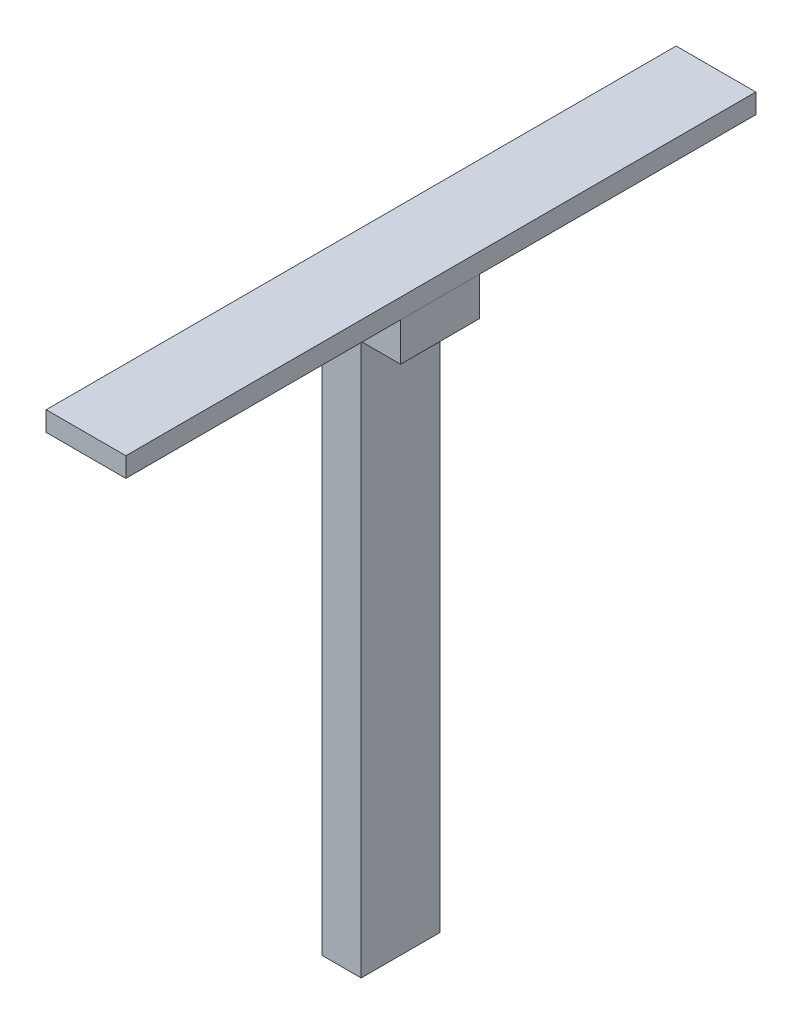
from build123d import *

# Parameters (mm, degrees)
EXTRUDE_1_DEPTH      = 150
EXTRUDE_2_DEPTH      = 70
EXTRUDE_2_DEPTH_BACK = 90
SKETCH_7_W           = 20.232494165
SKETCH_7_H           = 5
SKETCH_8_W           = 10
SKETCH_8_H           = 20
CUT_EXTRUDE_1_DEPTH  = 140


with BuildPart() as part:
    # Sketch 3D_1 → 凸台-拉伸1 (new body)
    with BuildSketch(Plane(origin=(0, 0, 0), x_dir=(0.7071067811865476, 0, 0.7071067811865476), z_dir=(0, 1, 0))):
        Polygon((0, 0), (14.142135624, 14.142135624), (28.284271247, 0), (14.142135624, -14.142135624), align=None)
    extrude(amount=EXTRUDE_1_DEPTH)

    # 草图8 → 切除-拉伸1 (cut)
    with BuildSketch(Plane(origin=(0, 0, 0), x_dir=(-1, 0, 0), z_dir=(0, -1, 0))):
        with Locations((-15, -10)):
            Rectangle(SKETCH_8_W, SKETCH_8_H)
    extrude(amount=-CUT_EXTRUDE_1_DEPTH, mode=Mode.SUBTRACT)


with BuildPart() as body_2:
    # 草图7 → 凸台-拉伸2 (new, two sides: drawn at the far end of the back side and taken through both)
    with BuildSketch(Plane.XY.offset(20).offset(-EXTRUDE_2_DEPTH_BACK)):
        with Locations((10.116247083, 152.5)):
            Rectangle(SKETCH_7_W, SKETCH_7_H)
    extrude(amount=EXTRUDE_2_DEPTH + EXTRUDE_2_DEPTH_BACK)


solid = Compound([part.part, body_2.part])
